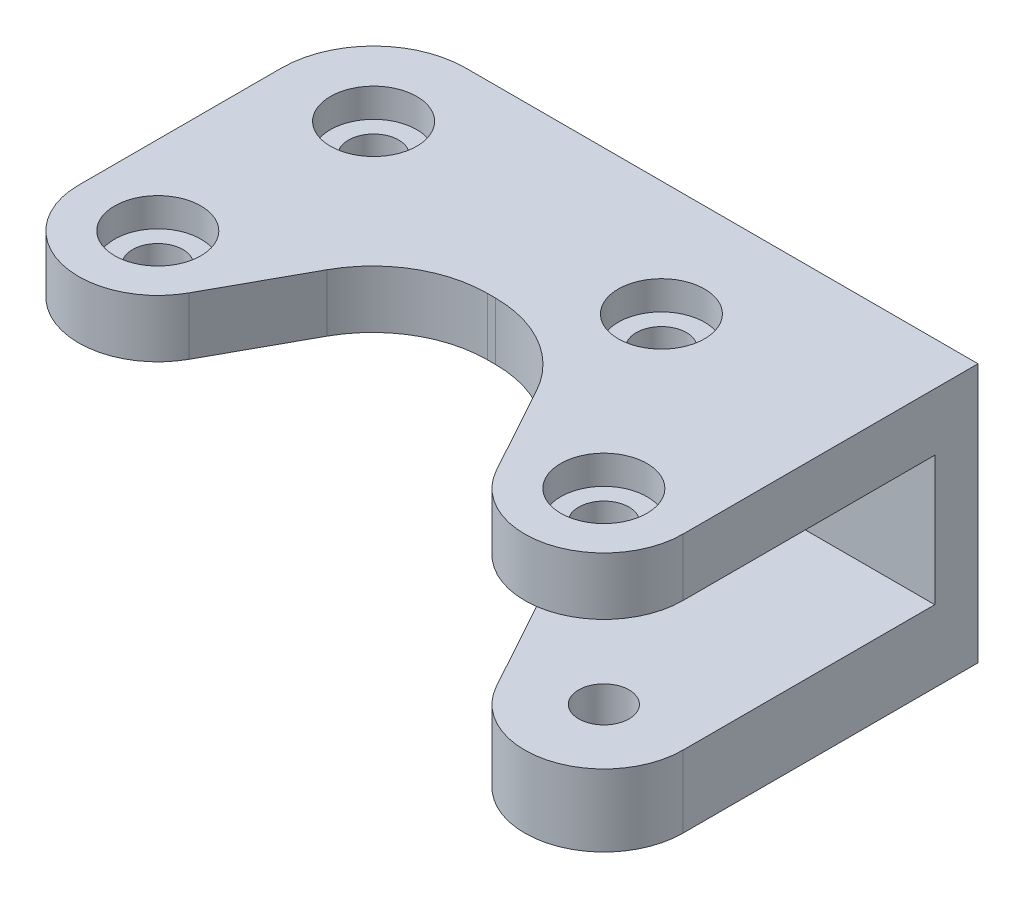
from build123d import *

# Parameters (mm, degrees)
SKETCH1_R           = 1.75
BOSS_EXTRUDE1_DEPTH = 18
SKETCH2_R           = 3
CUT_EXTRUDE1_DEPTH  = 2
CUT_EXTRUDE2_START  = -3
SKETCH4_W           = 42
SKETCH4_H           = 9
CUT_EXTRUDE2_DEPTH  = 35.960505792
CUT_EXTRUDE3_DEPTH  = 14
FILLET1_R           = 8
CUT_EXTRUDE4_DEPTH  = 37.235341864
SKETCH8_R           = 1.75
CUT_EXTRUDE5_DEPTH  = 7
SKETCH9_R           = 1.75
CUT_EXTRUDE6_DEPTH  = 10
SKETCH10_R          = 3
CUT_EXTRUDE7_DEPTH  = 2
SKETCH11_R          = 3
CUT_EXTRUDE8_DEPTH  = 1
FILLET2_R           = 6.41


with BuildPart() as part:
    # Sketch1 → Boss-Extrude1 (new body)
    with BuildSketch(Plane(origin=(0, 0, 0), x_dir=(1, 0, 0), z_dir=(0, 1, 0))):
        with BuildLine():
            Line((-21, 0), (21, 0))
            Line((21, 0), (21, -20.5))
            ThreePointArc((21, -20.5), (16.867011836, -25.827408248), (10.67953504, -23.148229139))
            Line((10.67953504, -23.148229139), (5, -12.81))
            Line((5, -12.81), (-5, -12.81))
            Line((-5, -12.81), (-10.67953504, -23.148229139))
            ThreePointArc((-10.67953504, -23.148229139), (-16.867011836, -25.827408248), (-21, -20.5))
            Line((-21, -20.5), (-21, 0))
        make_face()
        with Locations(Location((15.5, -20.5, 0), (0, 0, 270))):
            Circle(SKETCH1_R, mode=Mode.SUBTRACT)
        with Locations(Location((-15.5, -20.5, 0), (0, 0, 270))):
            Circle(SKETCH1_R, mode=Mode.SUBTRACT)
    extrude(amount=BOSS_EXTRUDE1_DEPTH)

    # Sketch2 → Cut-Extrude1 (cut)
    with BuildSketch(Plane(origin=(0, 18, 0), x_dir=(1, 0, 0), z_dir=(0, 1, 0))):
        with Locations(Location((-15.5, -20.5, 0), (0, 0, 270))):
            Circle(SKETCH2_R)
        with Locations(Location((15.5, -20.5, 0), (0, 0, 270))):
            Circle(SKETCH2_R)
    extrude(amount=-CUT_EXTRUDE1_DEPTH, mode=Mode.SUBTRACT)

    # Sketch4 → Cut-Extrude2 (cut, through all)
    with BuildSketch(Plane(origin=(0, 0, 0), x_dir=(-1, 0, 0), z_dir=(0, 0, -1)).offset(CUT_EXTRUDE2_START)):
        with Locations((0, 9.5)):
            Rectangle(SKETCH4_W, SKETCH4_H)
    extrude(amount=-CUT_EXTRUDE2_DEPTH, mode=Mode.SUBTRACT)

    # Sketch6 → Cut-Extrude3 (cut)
    with BuildSketch(Plane.XZ):
        Polygon((5, 12.81), (-2.037457082, 0), (-21, 0), (-21, 28.272610559), (5, 28.272610559), align=None)
    extrude(amount=-CUT_EXTRUDE3_DEPTH, mode=Mode.SUBTRACT)

    # Fillet1
    fillet1_edges = [part.edges().sort_by_distance(p)[0] for p in [
        (5, 16, 12.81),
        (-5, 16, 12.81),
    ]]
    fillet(fillet1_edges, radius=FILLET1_R)

    # Sketch7 → Cut-Extrude4 (cut, through all)
    with BuildSketch(Plane.XZ.offset(-14)):
        Polygon((0, 0), (0, 4.340639875), (-2.037457082, 0), align=None)
    extrude(amount=CUT_EXTRUDE4_DEPTH, mode=Mode.SUBTRACT)

    # Sketch8 → Cut-Extrude5 (cut)
    with BuildSketch(Plane(origin=(0, 0, 0), x_dir=(-1, 0, 0), z_dir=(0, 0, -1))):
        with Locations((-14, 9.5)):
            Circle(SKETCH8_R)
    extrude(amount=-CUT_EXTRUDE5_DEPTH, mode=Mode.SUBTRACT)

    # Sketch9 → Cut-Extrude6 (cut)
    with BuildSketch(Plane(origin=(0, 18, 0), x_dir=(1, 0, 0), z_dir=(0, 1, 0))):
        with Locations(Location((7, -8, 0), (0, 0, 270))):
            Circle(SKETCH9_R)
        with Locations(Location((-14.59, -6.41, 0), (0, 0, 270))):
            Circle(SKETCH9_R)
    extrude(amount=-CUT_EXTRUDE6_DEPTH, mode=Mode.SUBTRACT)

    # Sketch10 → Cut-Extrude7 (cut)
    with BuildSketch(Plane(origin=(0, 18, 0), x_dir=(1, 0, 0), z_dir=(0, 1, 0))):
        with Locations(Location((7, -8, 0), (0, 0, 270))):
            Circle(SKETCH10_R)
        with Locations(Location((-14.59, -6.41, 0), (0, 0, 270))):
            Circle(SKETCH10_R)
    extrude(amount=-CUT_EXTRUDE7_DEPTH, mode=Mode.SUBTRACT)

    # Sketch11 → Cut-Extrude8 (cut)
    with BuildSketch(Plane(origin=(0, 0, 0), x_dir=(-1, 0, 0), z_dir=(0, 0, -1))):
        with Locations((-14, 9.5)):
            Circle(SKETCH11_R)
    extrude(amount=-CUT_EXTRUDE8_DEPTH, mode=Mode.SUBTRACT)

    # Fillet2
    fillet2_edges = [part.edges().sort_by_distance(p)[0] for p in [
        (-21, 16, 0),
    ]]
    fillet(fillet2_edges, radius=FILLET2_R)


solid = part.part
